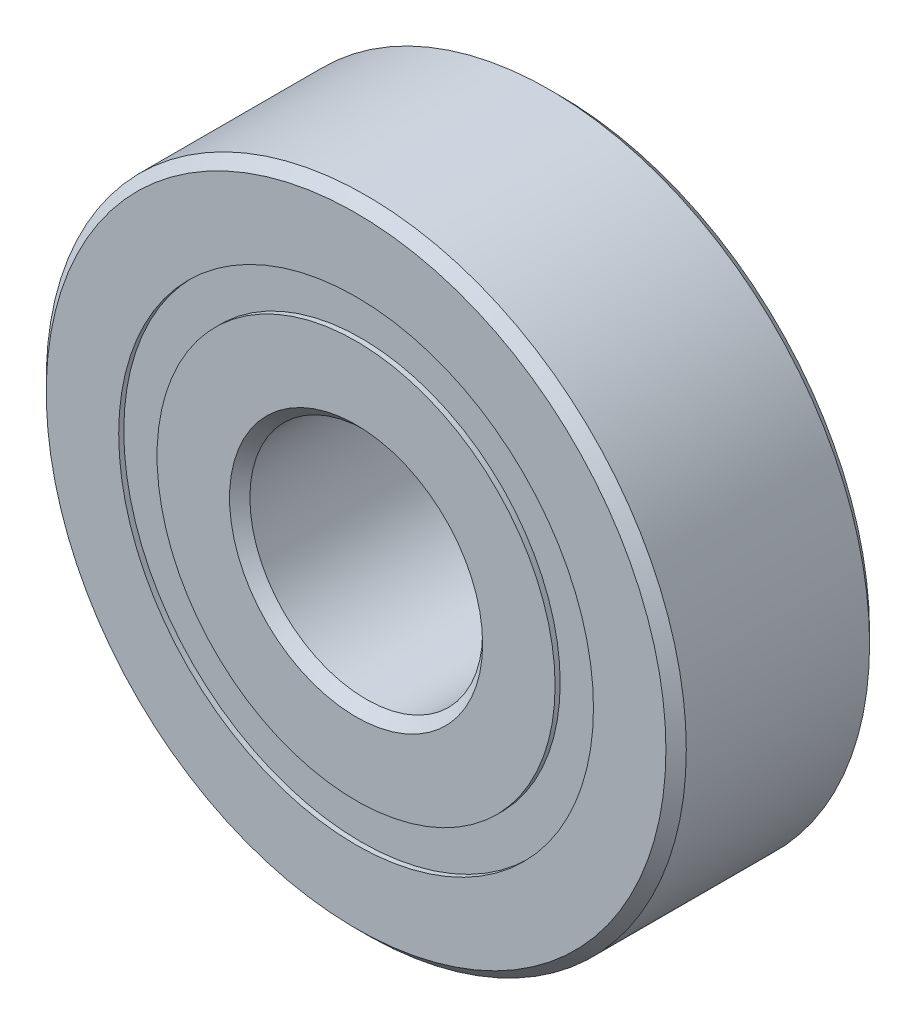
from build123d import *

# Parameters (mm, degrees)
CIRPATTERN1_COUNT = 12
SKETCH5_W         = 1.635478413
SKETCH5_H         = 1.318681318


with BuildPart() as part:
    # Sketch6 → Revolve1 (revolve)
    with BuildSketch(Plane(origin=(0, 0, 0), x_dir=(0, 0, -1), z_dir=(1, 0, 0))):
        with BuildLine():
            Line((-3.5, 10.65), (-3.5, 8.159340659))
            Line((-3.5, 8.159340659), (-1.555555556, 8.159340659))
            ThreePointArc((-1.555555556, 8.159340659), (0, 9.189521587), (1.555555556, 8.159340659))
            Line((1.555555556, 8.159340659), (3.5, 8.159340659))
            Line((3.5, 8.159340659), (3.5, 10.65))
            Line((3.5, 10.65), (3.15, 11))
            Line((3.15, 11), (-3.15, 11))
            Line((-3.15, 11), (-3.5, 10.65))
        make_face()
        with BuildLine():
            Line((-3.5, 4.35), (-3.5, 6.840659341))
            Line((-3.5, 6.840659341), (-1.555555556, 6.840659341))
            ThreePointArc((-1.555555556, 6.840659341), (0, 5.810478413), (1.555555556, 6.840659341))
            Line((1.555555556, 6.840659341), (3.5, 6.840659341))
            Line((3.5, 6.840659341), (3.5, 4.35))
            Line((3.5, 4.35), (3.15, 4))
            Line((3.15, 4), (-3.15, 4))
            Line((-3.15, 4), (-3.5, 4.35))
        make_face()
    revolve(axis=Axis((0, 0, 3.5), (0, 0, -1)))



with BuildPart() as body_2:
    # Sketch4 → Revolve2 (revolve)
    with BuildSketch(Plane(origin=(0, 0, 0), x_dir=(0, 0, -1), z_dir=(1, 0, 0))):
        with BuildLine():
            Line((-1.689521587, 7.5), (1.689521587, 7.5))
            ThreePointArc((1.689521587, 7.5), (0, 9.189521587), (-1.689521587, 7.5))
        make_face()
    revolve(axis=Axis((0, 7.5, 1.689521587), (0, 0, -1)))


with BuildPart() as cirpattern1_1:
    # CirPattern1: pattern copy
    add(body_2.part.rotate(Axis((0, 0, -3.5), (0, 0, 1)), 1 * 360 / CIRPATTERN1_COUNT))


with BuildPart() as cirpattern1_2:
    # CirPattern1: pattern copy
    add(body_2.part.rotate(Axis((0, 0, -3.5), (0, 0, 1)), 2 * 360 / CIRPATTERN1_COUNT))


with BuildPart() as cirpattern1_3:
    # CirPattern1: pattern copy
    add(body_2.part.rotate(Axis((0, 0, -3.5), (0, 0, 1)), 3 * 360 / CIRPATTERN1_COUNT))


with BuildPart() as cirpattern1_4:
    # CirPattern1: pattern copy
    add(body_2.part.rotate(Axis((0, 0, -3.5), (0, 0, 1)), 4 * 360 / CIRPATTERN1_COUNT))


with BuildPart() as cirpattern1_5:
    # CirPattern1: pattern copy
    add(body_2.part.rotate(Axis((0, 0, -3.5), (0, 0, 1)), 5 * 360 / CIRPATTERN1_COUNT))


with BuildPart() as cirpattern1_6:
    # CirPattern1: pattern copy
    add(body_2.part.rotate(Axis((0, 0, -3.5), (0, 0, 1)), 6 * 360 / CIRPATTERN1_COUNT))


with BuildPart() as cirpattern1_7:
    # CirPattern1: pattern copy
    add(body_2.part.rotate(Axis((0, 0, -3.5), (0, 0, 1)), 7 * 360 / CIRPATTERN1_COUNT))


with BuildPart() as cirpattern1_8:
    # CirPattern1: pattern copy
    add(body_2.part.rotate(Axis((0, 0, -3.5), (0, 0, 1)), 8 * 360 / CIRPATTERN1_COUNT))


with BuildPart() as cirpattern1_9:
    # CirPattern1: pattern copy
    add(body_2.part.rotate(Axis((0, 0, -3.5), (0, 0, 1)), 9 * 360 / CIRPATTERN1_COUNT))


with BuildPart() as cirpattern1_10:
    # CirPattern1: pattern copy
    add(body_2.part.rotate(Axis((0, 0, -3.5), (0, 0, 1)), 10 * 360 / CIRPATTERN1_COUNT))


with BuildPart() as cirpattern1_11:
    # CirPattern1: pattern copy
    add(body_2.part.rotate(Axis((0, 0, -3.5), (0, 0, 1)), 11 * 360 / CIRPATTERN1_COUNT))


with BuildPart() as part_1:
    add(part.part)

    add(body_2.part)  # Revolve3 merges body 2

    add(cirpattern1_1.part)  # Revolve3 merges CirPattern1_1

    add(cirpattern1_2.part)  # Revolve3 merges CirPattern1_2

    add(cirpattern1_3.part)  # Revolve3 merges CirPattern1_3

    add(cirpattern1_4.part)  # Revolve3 merges CirPattern1_4

    add(cirpattern1_5.part)  # Revolve3 merges CirPattern1_5

    add(cirpattern1_6.part)  # Revolve3 merges CirPattern1_6

    add(cirpattern1_7.part)  # Revolve3 merges CirPattern1_7

    add(cirpattern1_8.part)  # Revolve3 merges CirPattern1_8

    add(cirpattern1_9.part)  # Revolve3 merges CirPattern1_9

    add(cirpattern1_10.part)  # Revolve3 merges CirPattern1_10

    add(cirpattern1_11.part)  # Revolve3 merges CirPattern1_11
    # Sketch5 → Revolve3 (revolve)
    with BuildSketch(Plane(origin=(0, 0, 0), x_dir=(0, 0, -1), z_dir=(1, 0, 0))):
        with Locations((-2.507260794, 7.5)):
            Rectangle(SKETCH5_W, SKETCH5_H)
        with Locations((2.507260794, 7.5)):
            Rectangle(SKETCH5_W, SKETCH5_H)
    revolve(axis=Axis((0, 0, 3.5), (0, 0, -1)))


solid = part_1.part
